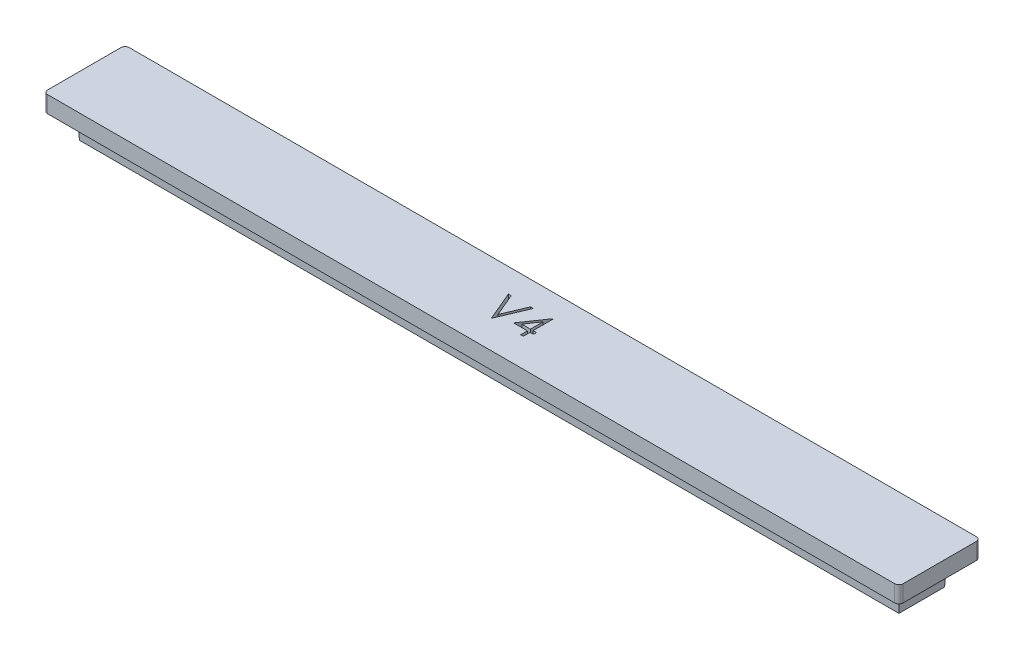
from build123d import *

# Parameters (mm, degrees)
SKETCH1_W           = 98.8
SKETCH1_H           = 5.8
BOSS_EXTRUDE1_DEPTH = 3
SKETCH2_W           = 100.8
SKETCH2_H           = 7.8
BOSS_EXTRUDE3_DEPTH = 2
DRAFT1_ANGLE        = 3
SKETCH3_W           = 102.8
SKETCH3_H           = 9.8
BOSS_EXTRUDE4_DEPTH = 2
FILLET1_R           = 0.5
CUT_EXTRUDE1_DEPTH  = 1


with BuildPart() as part:
    # Sketch1 → Boss-Extrude1 (new body)
    with BuildSketch(Plane(origin=(0, 0, 0), x_dir=(1, 0, 0), z_dir=(0, 1, 0))):
        Rectangle(SKETCH1_W, SKETCH1_H)
    extrude(amount=BOSS_EXTRUDE1_DEPTH)

    # Draft1
    draft1_faces = [part.faces().sort_by_distance(p)[0] for p in [
        (49.4, 1.5, 0),
        (0, 1.5, 2.9),
        (-49.4, 1.5, 0),
        (0, 1.5, -2.9),
    ]]
    draft(draft1_faces, Plane(origin=(0, 3, 0), x_dir=(0, 0, -1), z_dir=(0, -1, 0)), DRAFT1_ANGLE)



with BuildPart() as body_2:
    # Sketch2 → Boss-Extrude3 (new body)
    with BuildSketch(Plane(origin=(0, 3, 0), x_dir=(1, 0, 0), z_dir=(0, 1, 0))):
        Rectangle(SKETCH2_W, SKETCH2_H)
    extrude(amount=BOSS_EXTRUDE3_DEPTH)


with BuildPart() as part_1:
    add(part.part)

    add(body_2.part)  # Boss-Extrude4 merges body 2
    # Sketch3 → Boss-Extrude4 (add)
    with BuildSketch(Plane(origin=(0, 5, 0), x_dir=(1, 0, 0), z_dir=(0, 1, 0))):
        Rectangle(SKETCH3_W, SKETCH3_H)
    extrude(amount=-BOSS_EXTRUDE4_DEPTH)

    # Fillet1
    fillet1_edges = [part_1.edges().sort_by_distance(p)[0] for p in [
        (-51.4, 4, 4.9),
        (-51.4, 4, -4.9),
        (51.4, 4, -4.9),
        (51.4, 4, 4.9),
    ]]
    fillet(fillet1_edges, radius=FILLET1_R)

    # Sketch4 → Cut-Extrude1 (cut)
    # profile 1 of 2: a face of its own
    with BuildSketch(Plane(origin=(0, 5, 0), x_dir=(1, 0, 0), z_dir=(0, 1, 0))):
        Polygon((-2.466339169, 2.034069186), (-2.129800707, 2.034069186), (-0.96313404, -0.724143955), (0.203532626, 2.034069186), (0.540071088, 2.034069186), (-0.940698143, -1.465930814), (-0.985569938, -1.465930814), align=None)
    # profile 2 of 2: a face of its own
    with BuildSketch(Plane(origin=(0, 5, 0), x_dir=(1, 0, 0), z_dir=(0, 1, 0))):
        Polygon((2.764730543, 2.123812775), (2.828532626, 2.123812775), (2.828532626, -0.299264148), (3.23237878, -0.299264148), (3.23237878, -0.658238507), (2.828532626, -0.658238507), (2.828532626, -1.465930814), (2.514430062, -1.465930814), (2.514430062, -0.658238507), (0.854173652, -0.658238507), align=None)
        Polygon((2.514430062, -0.299264148), (2.514430062, 1.220767903), (1.471160831, -0.299264148), align=None, mode=Mode.SUBTRACT)
    extrude(amount=-CUT_EXTRUDE1_DEPTH, mode=Mode.SUBTRACT)


solid = part_1.part
